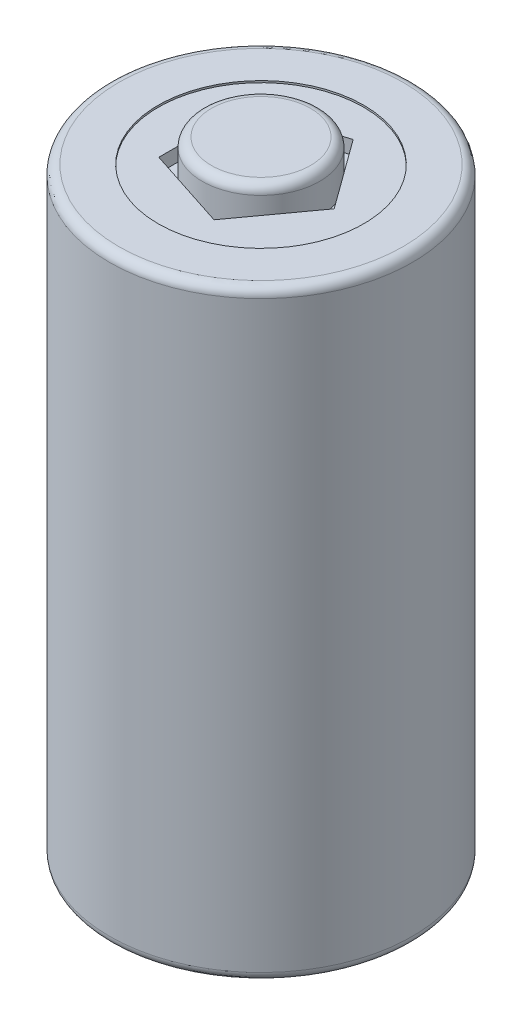
from build123d import *

# Parameters (mm, degrees)
SKETCH1_W           = 8.25
SKETCH1_H           = 32.8
SKETCH2_R           = 5.6
CUT_EXTRUDE1_DEPTH  = 0.75
CUT_EXTRUDE2_START  = -0.1
SKETCH3_R           = 5.6
CUT_EXTRUDE2_DEPTH  = 0.1
CUT_EXTRUDE3_DEPTH  = 0.75
SKETCH5_R           = 3.2
BOSS_EXTRUDE3_DEPTH = 2.15
FILLET1_R           = 0.5
SKETCH6_R           = 6.1
SKETCH6_R_2         = 5.6
CUT_EXTRUDE4_DEPTH  = 0.65
FILLET2_R           = 0.5


with BuildPart() as part:
    # Sketch1 → Base-Revolve (revolve)
    with BuildSketch(Plane.XY, mode=Mode.PRIVATE) as base_revolve_sk:
        with Locations((4.125, 0)):
            Rectangle(SKETCH1_W, SKETCH1_H)
    revolve(base_revolve_sk.sketch.rotate(Axis((0, -16.4, 0), (0, 1, 0)), 90), axis=Axis((0, -16.4, 0), (0, 1, 0)))

    # Sketch2 → Cut-Extrude1 (cut)
    with BuildSketch(Plane.XZ.offset(16.4)):
        with Locations(Location((0, 0, 0), (0, 0, 270))):
            Circle(SKETCH2_R)
    extrude(amount=-CUT_EXTRUDE1_DEPTH, mode=Mode.SUBTRACT)

    # Sketch3 → Cut-Extrude2 (cut)
    with BuildSketch(Plane(origin=(0, 16.4, 0), x_dir=(-1, 0, 0), z_dir=(0, 1, 0)).offset(CUT_EXTRUDE2_START)):
        with Locations(Location((0, 0, 0), (0, 0, 270))):
            Circle(SKETCH3_R)
    extrude(amount=CUT_EXTRUDE2_DEPTH, mode=Mode.SUBTRACT)

    # Sketch4 → Cut-Extrude3 (cut)
    with BuildSketch(Plane(origin=(0, 16.3, 0), x_dir=(-1, 0, 0), z_dir=(0, 1, 0))):
        Polygon((3.225, -2.343099653), (3.225, 2.343099653), (-1.231840386, 3.791214877), (-3.986319227, 0), (-1.231840386, -3.791214877), align=None)
    extrude(amount=-CUT_EXTRUDE3_DEPTH, mode=Mode.SUBTRACT)

    # Sketch5 → Boss-Extrude3 (add)
    with BuildSketch(Plane(origin=(0, 15.55, 0), x_dir=(-1, 0, 0), z_dir=(0, 1, 0))):
        with Locations(Location((0, 0, 0), (0, 0, 270))):
            Circle(SKETCH5_R)
    extrude(amount=BOSS_EXTRUDE3_DEPTH)

    # Fillet1
    fillet1_edges = [part.edges().sort_by_distance(p)[0] for p in [
        (0, 17.7, 3.2),
    ]]
    fillet(fillet1_edges, radius=FILLET1_R)

    # Sketch6 → Cut-Extrude4 (cut)
    with BuildSketch(Plane.XZ.offset(16.3)):
        with Locations(Location((0, 0, 0), (0, 0, 270))):
            Circle(SKETCH6_R)
        with Locations(Location((0, 0, 0), (0, 0, 270))):
            Circle(SKETCH6_R_2, mode=Mode.SUBTRACT)
    extrude(amount=-CUT_EXTRUDE4_DEPTH, mode=Mode.SUBTRACT)

    # Fillet2
    fillet2_edges = [part.edges().sort_by_distance(p)[0] for p in [
        (0, -16.4, 8.25),
        (0, 16.4, 8.25),
    ]]
    fillet(fillet2_edges, radius=FILLET2_R)


solid = part.part
